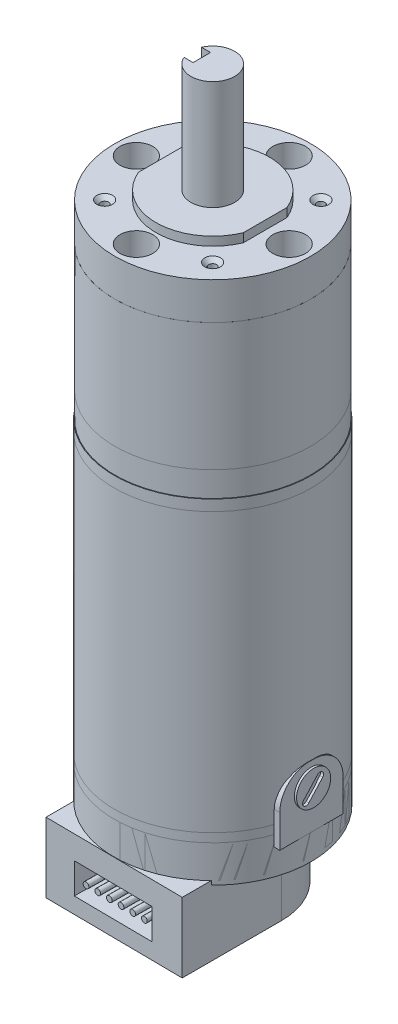
from build123d import *

# Parameters (mm, degrees)
SKETCH1_R               = 22.4
BOSS_EXTRUDE1_DEPTH     = 8.5
SKETCH2_R               = 22.4
BOSS_EXTRUDE3_DEPTH     = 29.2
SKETCH3_R               = 22.4
BOSS_EXTRUDE4_DEPTH     = 5.7
SKETCH6_R               = 22.55
BOSS_EXTRUDE5_DEPTH     = 2.5
SKETCH7_R               = 22.55
BOSS_EXTRUDE6_DEPTH     = 63.7
SKETCH8_R               = 22.55
BOSS_EXTRUDE7_DEPTH     = 2
SKETCH9_R               = 22.55
BOSS_EXTRUDE8_DEPTH     = 8.4
SKETCH10_R              = 13
BOSS_EXTRUDE9_DEPTH     = 2
SKETCH17_R              = 22.55
BOSS_EXTRUDE11_DEPTH    = 7.5
SKETCH11_R              = 5
BOSS_EXTRUDE10_DEPTH    = 25
CUT_EXTRUDE1_REACH      = 120.471
CUT_EXTRUDE1_END_RADIUS = 5
CUT_EXTRUDE1_START      = -2.5
SKETCH13_R              = 3.75
CUT_EXTRUDE2_DEPTH      = 15
CIRPATTERN1_COUNT       = 4
CUT_EXTRUDE4_START      = -2
CUT_EXTRUDE4_DEPTH      = 2
BOSS_EXTRUDE12_DEPTH    = 45.2
SKETCH18_R              = 3.908395226
BOSS_EXTRUDE13_DEPTH    = 0.5
CUT_EXTRUDE5_DEPTH      = 2
BOSS_EXTRUDE15_DEPTH    = 16
SKETCH22_W              = 18
SKETCH22_H              = 7
CUT_EXTRUDE6_DEPTH      = 16
SKETCH23_R              = 0.663702
BOSS_EXTRUDE16_DEPTH    = 16


with BuildPart() as part:
    # Sketch1 → Boss-Extrude1 (new body)
    with BuildSketch(Plane(origin=(0, 0, 0), x_dir=(1, 0, 0), z_dir=(0, 1, 0))):
        with Locations(Location((0, 0, 0), (0, 0, 270))):
            Circle(SKETCH1_R)
    extrude(amount=BOSS_EXTRUDE1_DEPTH)

    # Sketch10 → Boss-Extrude9 (add)
    with BuildSketch(Plane(origin=(0, 8.5, 0), x_dir=(1, 0, 0), z_dir=(0, 1, 0))):
        with Locations(Location((0, 0, 0), (0, 0, 270))):
            Circle(SKETCH10_R)
    extrude(amount=BOSS_EXTRUDE9_DEPTH)


with BuildPart() as body_2:
    # Sketch2 → Boss-Extrude3 (new body)
    with BuildSketch(Plane.XZ):
        with Locations(Location((0, 0, 0), (0, 0, 270))):
            Circle(SKETCH2_R)
    extrude(amount=BOSS_EXTRUDE3_DEPTH)


with BuildPart() as body_3:
    # Sketch3 → Boss-Extrude4 (new body)
    with BuildSketch(Plane.XZ.offset(29.2)):
        with Locations(Location((0, 0, 0), (0, 0, 270))):
            Circle(SKETCH3_R)
    extrude(amount=BOSS_EXTRUDE4_DEPTH)


with BuildPart() as body_4:
    # Sketch6 → Boss-Extrude5 (new body)
    with BuildSketch(Plane.XZ.offset(34.9)):
        with Locations(Location((0, 0, 0), (0, 0, 270))):
            Circle(SKETCH6_R)
    extrude(amount=BOSS_EXTRUDE5_DEPTH)


with BuildPart() as body_5:
    # Sketch7 → Boss-Extrude6 (new body)
    with BuildSketch(Plane.XZ.offset(37.4)):
        with Locations(Location((0, 0, 0), (0, 0, 270))):
            Circle(SKETCH7_R)
    extrude(amount=BOSS_EXTRUDE6_DEPTH)


with BuildPart() as body_6:
    # Sketch8 → Boss-Extrude7 (new body)
    with BuildSketch(Plane.XZ.offset(101.1)):
        with Locations(Location((0, 0, 0), (0, 0, 270))):
            Circle(SKETCH8_R)
    extrude(amount=BOSS_EXTRUDE7_DEPTH)


with BuildPart() as body_7:
    # Sketch9 → Boss-Extrude8 (new body)
    with BuildSketch(Plane.XZ.offset(103.1)):
        with Locations(Location((0, 0, 0), (0, 0, 270))):
            Circle(SKETCH9_R)
    extrude(amount=BOSS_EXTRUDE8_DEPTH)


with BuildPart() as body_8:
    # Sketch17 → Boss-Extrude11 (new body)
    with BuildSketch(Plane.XZ.offset(103.1)):
        with Locations(Location((0, 0, 0), (0, 0, 270))):
            Circle(SKETCH17_R)
    extrude(amount=BOSS_EXTRUDE11_DEPTH)


with BuildPart() as body_9:
    # Sketch11 → Boss-Extrude10 (new body)
    with BuildSketch(Plane(origin=(0, 10.5, 0), x_dir=(1, 0, 0), z_dir=(0, 1, 0))):
        with Locations(Location((0, 0, 0), (0, 0, 270))):
            Circle(SKETCH11_R)
    extrude(amount=BOSS_EXTRUDE10_DEPTH)

    # Cut-Extrude1: up to this cylinder (the profile starts inside it)
    cut_extrude1_end = Plane(origin=(0, 28.219548, 0), z_dir=(0, -1, 0)) * Cylinder(CUT_EXTRUDE1_END_RADIUS, 251.942, mode=Mode.PRIVATE)
    # Sketch12 → Cut-Extrude1 (cut, up to the surface)
    with BuildSketch(Plane(origin=(0, 0, 0), x_dir=(0, 0, -1), z_dir=(1, 0, 0)).offset(CUT_EXTRUDE1_START), mode=Mode.PRIVATE) as cut_extrude1_sk1:
        with BuildLine():
            Line((-2, 17.5), (-2, 38.939095555))
            ThreePointArc((-2, 38.939095555), (0, 40.939095555), (2, 38.939095555))
            Line((2, 38.939095555), (2, 17.5))
            ThreePointArc((2, 17.5), (0, 15.5), (-2, 17.5))
        make_face()
    cut_extrude1_tool1 = extrude(cut_extrude1_sk1.sketch, amount=-CUT_EXTRUDE1_REACH, mode=Mode.PRIVATE) & cut_extrude1_end
    add(cut_extrude1_tool1.solids().sort_by_distance((-2.5, 28.219548, 0))[0], mode=Mode.SUBTRACT)


with BuildPart() as cut_extrude2_tool:
    # Sketch13 → Cut-Extrude2 (new body)
    with BuildSketch(Plane(origin=(0, 8.5, 0), x_dir=(1, 0, 0), z_dir=(0, 1, 0))):
        with Locations(Location((0, 17.5, 0), (0, 0, 270))):
            Circle(SKETCH13_R)
        with Locations(Location((17.5, 0, 0), (0, 0, 270))):
            Circle(SKETCH13_R)
        with Locations(Location((0, -17.5, 0), (0, 0, 270))):
            Circle(SKETCH13_R)
        with Locations(Location((-17.5, 0, 0), (0, 0, 270))):
            Circle(SKETCH13_R)
    extrude(amount=-CUT_EXTRUDE2_DEPTH)


with BuildPart() as part_1:
    add(part.part)

    # Cut-Extrude2: cut by cut_extrude2_tool
    add(cut_extrude2_tool.part, mode=Mode.SUBTRACT)


with BuildPart() as body_2_1:
    add(body_2.part)

    # Cut-Extrude2: cut by cut_extrude2_tool
    add(cut_extrude2_tool.part, mode=Mode.SUBTRACT)


with BuildPart() as csk_for_m1_6_countersunk_flat_head_screw_tool:
    # Sketch14 → CSK for M1.6 Countersunk Flat Head Screw1 (revolve)
    with BuildSketch(Plane(origin=(-12.367340813, 8.5, -12.3975363), x_dir=(0, 0, 1), z_dir=(1, 0, 0))):
        Polygon((0, 0), (0, 15.540774557), (0.9, 15), (0.9, 0.9), (1.8, 0), align=None)
    csk_for_m1_6_countersunk_flat_head_screw = revolve(axis=Axis((-12.367340813, 14.85, -12.3975363), (0, -1, 0)))


with BuildPart() as part_2:
    add(part_1.part)

    # CSK for M1.6 Countersunk Flat Head Screw1: cut by csk_for_m1_6_countersunk_flat_head_screw_tool
    add(csk_for_m1_6_countersunk_flat_head_screw_tool.part, mode=Mode.SUBTRACT)


with BuildPart() as body_2_2:
    add(body_2_1.part)

    # CSK for M1.6 Countersunk Flat Head Screw1: cut by csk_for_m1_6_countersunk_flat_head_screw_tool
    add(csk_for_m1_6_countersunk_flat_head_screw_tool.part, mode=Mode.SUBTRACT)


with BuildPart() as cirpattern1_tool:
    # CirPattern1: CSK for M1.6 Countersunk Flat Head Screw1 ×4 about axis
    cirpattern1_axis = Axis((0, 0, 0), (0, 1, 0))
    for i in range(1, CIRPATTERN1_COUNT):
        add(csk_for_m1_6_countersunk_flat_head_screw.rotate(cirpattern1_axis, i * 360 / CIRPATTERN1_COUNT))


with BuildPart() as part_3:
    add(part_2.part)

    # CirPattern1: cut by cirpattern1_tool
    add(cirpattern1_tool.part, mode=Mode.SUBTRACT)

    # Sketch15 → Cut-Extrude4 (cut)
    with BuildSketch(Plane(origin=(0, 10.5, 0), x_dir=(1, 0, 0), z_dir=(0, 1, 0)).offset(CUT_EXTRUDE4_START)):
        with BuildLine():
            Line((-12, 5), (-12, -5))
            ThreePointArc((-12, -5), (-13, 0), (-12, 5))
        make_face()
        with BuildLine():
            Line((12, 5), (12, -5))
            ThreePointArc((12, -5), (13, 0), (12, 5))
        make_face()
    extrude(amount=CUT_EXTRUDE4_DEPTH, mode=Mode.SUBTRACT)


with BuildPart() as body_2_3:
    add(body_2_2.part)

    # CirPattern1: cut by cirpattern1_tool
    add(cirpattern1_tool.part, mode=Mode.SUBTRACT)


with BuildPart() as body_10:
    # Sketch16 → Boss-Extrude12 (new body)
    with BuildSketch(Plane(origin=(22.6, 0, 0), x_dir=(0, 0, -1), z_dir=(1, 0, 0))):
        with BuildLine():
            Line((-7.25, -105.6), (-7.25, -98.1))
            ThreePointArc((-7.25, -98.1), (-5.09059186, -93.16409836), (0, -91.4))
            ThreePointArc((0, -91.4), (5.09059186, -93.16409836), (7.25, -98.1))
            Line((7.25, -98.1), (7.25, -105.6))
            Line((7.25, -105.6), (-7.25, -105.6))
        make_face()
    extrude(amount=-BOSS_EXTRUDE12_DEPTH)

    # Sketch18 → Boss-Extrude13 (add)
    with BuildSketch(Plane(origin=(22.6, 0, 0), x_dir=(0, 0, -1), z_dir=(1, 0, 0))):
        with Locations((0, -96.612706452)):
            Circle(SKETCH18_R)
    boss_extrude13 = extrude(amount=BOSS_EXTRUDE13_DEPTH)

    # Sketch19 → Cut-Extrude5 (cut)
    with BuildSketch(Plane(origin=(23.1, 0, 0), x_dir=(0, 0, -1), z_dir=(1, 0, 0))):
        with BuildLine():
            Line((2.092690975, -95.520669405), (-1.11608692, -99.031210012))
            ThreePointArc((-1.11608692, -99.031210012), (-2.257464068, -99.08246894), (-2.308722996, -97.941091793))
            Line((-2.308722996, -97.941091793), (0.9000549, -94.430551185))
            ThreePointArc((0.9000549, -94.430551185), (2.041432047, -94.379292257), (2.092690975, -95.520669405))
        make_face()
    cut_extrude5 = extrude(amount=-CUT_EXTRUDE5_DEPTH, mode=Mode.SUBTRACT)

    # Mirror25: Boss-Extrude13 across plane
    add(boss_extrude13.mirror(Plane(origin=(0, 0, 0), x_dir=(0, 0, 1), z_dir=(1, 0, 0))))

    # Mirror25 2: Cut-Extrude5 across plane
    add(cut_extrude5.mirror(Plane(origin=(0, 0, 0), x_dir=(0, 0, 1), z_dir=(1, 0, 0))), mode=Mode.SUBTRACT)


with BuildPart() as body_11:
    # Sketch21 → Boss-Extrude15 (new body)
    with BuildSketch(Plane.XZ.offset(110.6)):
        with BuildLine():
            Line((-15.75, 0), (-15.75, 22.441201119))
            Line((-15.75, 22.441201119), (15.75, 22.748302789))
            Line((15.75, 22.748302789), (15.75, 0))
            ThreePointArc((15.75, 0), (0, -15.75), (-15.75, 0))
        make_face()
    extrude(amount=BOSS_EXTRUDE15_DEPTH)

    # Sketch22 → Cut-Extrude6 (cut)
    with BuildSketch(Plane(origin=(-0.220261162, 0, 22.592604571), x_dir=(0.9999524793583892, 0, 0.009748796080048956), z_dir=(-0.009748796080048958, 0, 0.9999524793583893))):
        with Locations((0, -119.436625019)):
            Rectangle(SKETCH22_W, SKETCH22_H)
    extrude(amount=-CUT_EXTRUDE6_DEPTH, mode=Mode.SUBTRACT)

    # Sketch23 → Boss-Extrude16 (add)
    with BuildSketch(Plane(origin=(-0.064280425, 0, 6.593364901), x_dir=(0.9999524793583892, 0, 0.009748796080049117), z_dir=(-0.009748796080049119, 0, 0.9999524793583893))):
        with Locations((7.220003325, -119.436625019)):
            Circle(SKETCH23_R)
        with Locations((4.520003325, -119.436625019)):
            Circle(SKETCH23_R)
        with Locations((1.820003325, -119.436625019)):
            Circle(SKETCH23_R)
        with Locations((-0.879996675, -119.436625019)):
            Circle(SKETCH23_R)
        with Locations((-3.579996675, -119.436625019)):
            Circle(SKETCH23_R)
        with Locations((-6.279996675, -119.436625019)):
            Circle(SKETCH23_R)
    extrude(amount=BOSS_EXTRUDE16_DEPTH)


solid = Compound([body_3.part, body_4.part, body_5.part, body_6.part, body_7.part, body_8.part, body_9.part, part_3.part, body_2_3.part, body_10.part, body_11.part])
